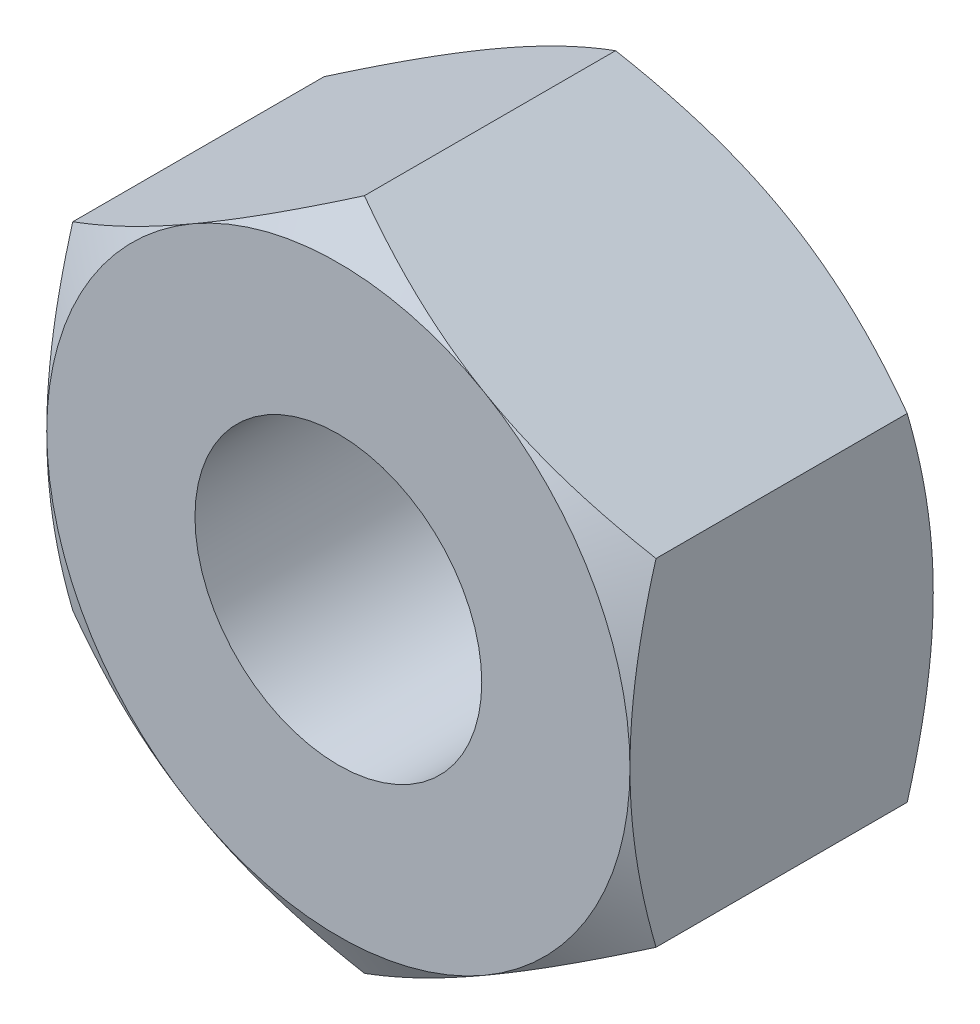
from build123d import *

# Parameters (mm, degrees)
SKETCH_1_R          = 2.45875
EXTRUDE_690_DEPTH   = 5.2
SKETCH_2_OUTSIDE_W  = 50.698
SKETCH_2_OUTSIDE_H  = 52.246
SKETCH_2_OUTSIDE_R  = 5
CUT_EXTRUDE_1_DEPTH = 10.239769117
CUT_EXTRUDE_1_DRAFT = -60
SKETCH_3_OUTSIDE_W  = 50.698
SKETCH_3_OUTSIDE_H  = 52.246
SKETCH_3_OUTSIDE_R  = 5
CUT_EXTRUDE_2_DEPTH = 10.239769117
CUT_EXTRUDE_2_DRAFT = -60


with BuildPart() as part:
    # 草图1 → Extrude 690 (new body)
    with BuildSketch(Plane.XY):
        Polygon((0, 5.773502692), (-5, 2.886751346), (-5, -2.886751346), (0, -5.773502692), (5, -2.886751346), (5, 2.886751346), align=None)
        Circle(SKETCH_1_R, mode=Mode.SUBTRACT)
    extrude(amount=EXTRUDE_690_DEPTH)


with BuildPart() as cut_extrude_1_tool:
    # 草图2 outside → 切除-拉伸1 (with draft: the straight prism first)
    with BuildSketch(Plane(origin=(0, 0, 0), x_dir=(-1, 0, 0), z_dir=(0, 0, -1))):
        Rectangle(SKETCH_2_OUTSIDE_W, SKETCH_2_OUTSIDE_H)
        Circle(SKETCH_2_OUTSIDE_R, mode=Mode.SUBTRACT)
    extrude(amount=-CUT_EXTRUDE_1_DEPTH)
    # 切除-拉伸1: the draft: its side faces are tilted about the plane it starts from
    cut_extrude_1_sides = [cut_extrude_1_tool.faces().sort_by_distance(p)[0] for p in [
        (0, -26.123, 5.119884558),
        (-25.349, 0, 5.119884558),
        (0, 26.123, 5.119884558),
        (25.349, 0, 5.119884558),
        (5, 0, 5.119884558),
    ]]
    draft(cut_extrude_1_sides, Plane(origin=(0, 0, 0), x_dir=(-1, 0, 0), z_dir=(0, 0, -1)), CUT_EXTRUDE_1_DRAFT)


with BuildPart() as part_1:
    add(part.part)

    # 切除-拉伸1: cut by cut_extrude_1_tool
    add(cut_extrude_1_tool.part, mode=Mode.SUBTRACT)


with BuildPart() as cut_extrude_2_tool:
    # 草图3 outside → 切除-拉伸2 (with draft: the straight prism first)
    with BuildSketch(Plane.XY.offset(5.2)):
        Rectangle(SKETCH_3_OUTSIDE_W, SKETCH_3_OUTSIDE_H)
        Circle(SKETCH_3_OUTSIDE_R, mode=Mode.SUBTRACT)
    extrude(amount=-CUT_EXTRUDE_2_DEPTH)
    # 切除-拉伸2: the draft: its side faces are tilted about the plane it starts from
    cut_extrude_2_sides = [cut_extrude_2_tool.faces().sort_by_distance(p)[0] for p in [
        (0, -26.123, 0.080115442),
        (25.349, 0, 0.080115442),
        (0, 26.123, 0.080115442),
        (-25.349, 0, 0.080115442),
        (-5, 0, 0.080115442),
    ]]
    draft(cut_extrude_2_sides, Plane.XY.offset(5.2), CUT_EXTRUDE_2_DRAFT)


with BuildPart() as part_2:
    add(part_1.part)

    # 切除-拉伸2: cut by cut_extrude_2_tool
    add(cut_extrude_2_tool.part, mode=Mode.SUBTRACT)


solid = part_2.part
